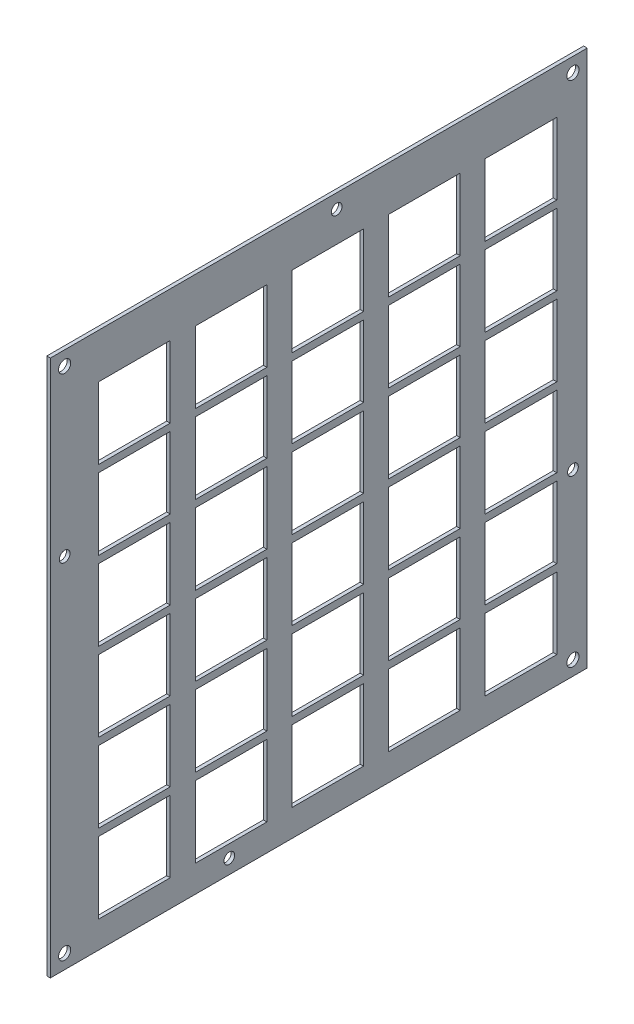
from build123d import *

# Parameters (mm, degrees)
SKETCH2_W            = 150
SKETCH2_H            = 150
BOSS_EXTRUDE1_DEPTH  = 1
SKETCH4_W            = 20
SKETCH4_H            = 20
CUT_EXTRUDE1_DEPTH   = 160.418359102
LPATTERN1_COUNT      = 5
LPATTERN1_PITCH      = 27
LPATTERN1_COUNT_DIR2 = 6
LPATTERN1_PITCH_DIR2 = 22
M3_CLEARANCE_HOLE1_D = 3.4
SKETCH8_R            = 1.5
CUT_EXTRUDE2_DEPTH   = 160.418359102


with BuildPart() as part:
    # Sketch2 → Boss-Extrude1 (new body)
    with BuildSketch(Plane(origin=(0, 0, 0), x_dir=(0, 0, -1), z_dir=(1, 0, 0))):
        with Locations((34.101040119, -41.233283804)):
            Rectangle(SKETCH2_W, SKETCH2_H)
    extrude(amount=BOSS_EXTRUDE1_DEPTH)

    # Sketch4 → Cut-Extrude1 (cut, through all)
    with BuildSketch(Plane(origin=(1, 0, 0), x_dir=(0, 0, -1), z_dir=(1, 0, 0))):
        with Locations((-17.398959881, 11.266716196)):
            Rectangle(SKETCH4_W, SKETCH4_H)
    cut_extrude1 = extrude(amount=-CUT_EXTRUDE1_DEPTH, mode=Mode.SUBTRACT)

    # LPattern1: Cut-Extrude1 5 × 6
    with Locations(*[(0, -j * LPATTERN1_PITCH_DIR2, -i * LPATTERN1_PITCH) for i in range(LPATTERN1_COUNT) for j in range(LPATTERN1_COUNT_DIR2) if (i, j) != (0, 0)]):
        add(cut_extrude1, mode=Mode.SUBTRACT)

    # M3 Clearance Hole1 (through all)
    with Locations(Plane(origin=(1, 0, 0), x_dir=(0, 0, -1), z_dir=(1, 0, 0))):
        with Locations((-36.898959881, 29.766716196), (105.101040119, 29.766716196), (105.101040119, -112.233283804), (-36.898959881, -112.233283804)):
            Hole(M3_CLEARANCE_HOLE1_D / 2)

    # Sketch8 → Cut-Extrude2 (cut, through all)
    with BuildSketch(Plane(origin=(1, 0, 0), x_dir=(0, 0, -1), z_dir=(1, 0, 0))):
        with Locations((39.101040119, 29.766716196)):
            Circle(SKETCH8_R)
        with Locations((-36.898959881, -16.233283804)):
            Circle(SKETCH8_R)
        with Locations((9.101040119, -112.233283804)):
            Circle(SKETCH8_R)
        with Locations((105.101040119, -66.233283804)):
            Circle(SKETCH8_R)
    extrude(amount=-CUT_EXTRUDE2_DEPTH, mode=Mode.SUBTRACT)


solid = part.part
